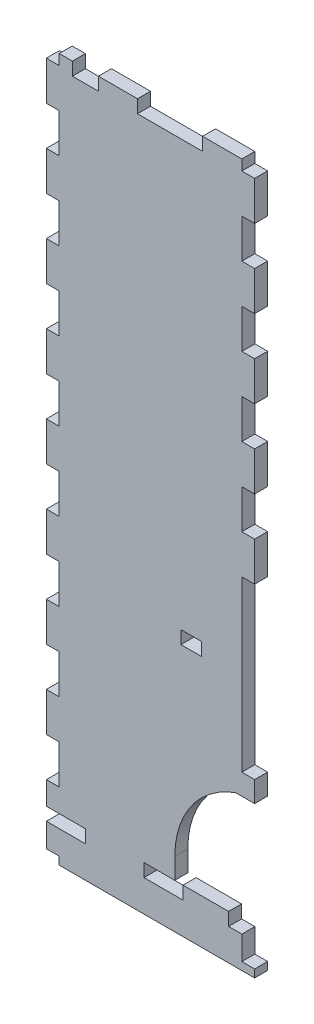
from build123d import *

# Parameters (mm, degrees)
BOSS_EXTRU_1_DEPTH      = 5
ESQUISSE2_W             = 8
ESQUISSE2_H             = 5
ESQUISSE2_W_2           = 15
ESQUISSE2_W_3           = 4.92
ESQUISSE2_H_2           = 65
ESQUISSE2_H_3           = 3
ESQUISSE2_H_4           = 15
ESQUISSE2_W_4           = 10
ESQUISSE2_W_5           = 25
ENL_V_MAT_EXTRU_1_DEPTH = 5
ESQUISSE3_W             = 7.280585373
ESQUISSE3_H             = 3.947256303
BOSS_EXTRU_2_DEPTH      = 5


with BuildPart() as part:
    # Esquisse1 → Boss.-Extru.1 (new body)
    with BuildSketch(Plane.XY):
        with BuildLine():
            Line((0, 0), (80, 0))
            Line((80, 0), (80, 17.15))
            Line((80, 17.15), (49.330858803, 17.15))
            Line((49.330858803, 17.15), (49.330858803, 25.109342079))
            add(Edge.make_bspline(
                [(80, 59.779072791), (49.330858803, 55.600211761), (49.330858803, 25.109342079)],
                knots=[1.708281914, 1.708281914, 1.708281914, 3.141592654, 3.141592654, 3.141592654], degree=2, weights=[1, 0.754006918, 1]))
            Line((80, 59.779072791), (80, 270))
            Line((80, 270), (0, 270))
            Line((0, 270), (0, 0))
        make_face()
    extrude(amount=BOSS_EXTRU_1_DEPTH)

    # Esquisse2 → Enlèv. mat.-Extru.1 (cut)
    with BuildSketch(Plane.XY.offset(5)):
        with Locations((55.679721659, 99.250434868)):
            Rectangle(ESQUISSE2_W, ESQUISSE2_H)
        Polygon((75.08, 12.15), (70, 12.15), (70, 17.15), (80, 17.15), (80, 3), (75.08, 3), align=None)
        with Locations((45, 14.65)):
            Rectangle(ESQUISSE2_W_2, ESQUISSE2_H)
        with Locations((7.5, 14.65)):
            Rectangle(ESQUISSE2_W_2, ESQUISSE2_H)
        with Locations((77.54, 98.5)):
            Rectangle(ESQUISSE2_W_3, ESQUISSE2_H_2)
        with Locations((2.46, 1.5)):
            Rectangle(ESQUISSE2_W_3, ESQUISSE2_H_3)
        with Locations((77.54, 183.5)):
            Rectangle(ESQUISSE2_W_3, ESQUISSE2_H_4)
        with Locations((77.54, 153.5)):
            Rectangle(ESQUISSE2_W_3, ESQUISSE2_H_4)
        with Locations((77.54, 213.5)):
            Rectangle(ESQUISSE2_W_3, ESQUISSE2_H_4)
        with Locations((77.54, 243.5)):
            Rectangle(ESQUISSE2_W_3, ESQUISSE2_H_4)
        with Locations((77.54, 273.5)):
            Rectangle(ESQUISSE2_W_3, ESQUISSE2_H_4)
        with Locations((2.46, 273.5)):
            Rectangle(ESQUISSE2_W_3, ESQUISSE2_H_4)
        with Locations((2.46, 243.5)):
            Rectangle(ESQUISSE2_W_3, ESQUISSE2_H_4)
        with Locations((2.46, 213.5)):
            Rectangle(ESQUISSE2_W_3, ESQUISSE2_H_4)
        with Locations((2.46, 183.5)):
            Rectangle(ESQUISSE2_W_3, ESQUISSE2_H_4)
        with Locations((2.46, 153.5)):
            Rectangle(ESQUISSE2_W_3, ESQUISSE2_H_4)
        with Locations((2.46, 123.5)):
            Rectangle(ESQUISSE2_W_3, ESQUISSE2_H_4)
        with Locations((2.46, 93.5)):
            Rectangle(ESQUISSE2_W_3, ESQUISSE2_H_4)
        with Locations((2.46, 63.5)):
            Rectangle(ESQUISSE2_W_3, ESQUISSE2_H_4)
        with Locations((2.46, 33.5)):
            Rectangle(ESQUISSE2_W_3, ESQUISSE2_H_4)
        with Locations((15, 267.5)):
            Rectangle(ESQUISSE2_W_4, ESQUISSE2_H)
        with Locations((47.5, 267.5)):
            Rectangle(ESQUISSE2_W_5, ESQUISSE2_H)
    extrude(amount=-ENL_V_MAT_EXTRU_1_DEPTH, mode=Mode.SUBTRACT)

    # Esquisse3 → Boss.-Extru.2 (add)
    with BuildSketch(Plane(origin=(0, 0, 0), x_dir=(-1, 0, 0), z_dir=(0, 0, -1))):
        with Locations((-76.359707313, 59.973628152)):
            Rectangle(ESQUISSE3_W, ESQUISSE3_H)
    extrude(amount=-BOSS_EXTRU_2_DEPTH)


solid = part.part
